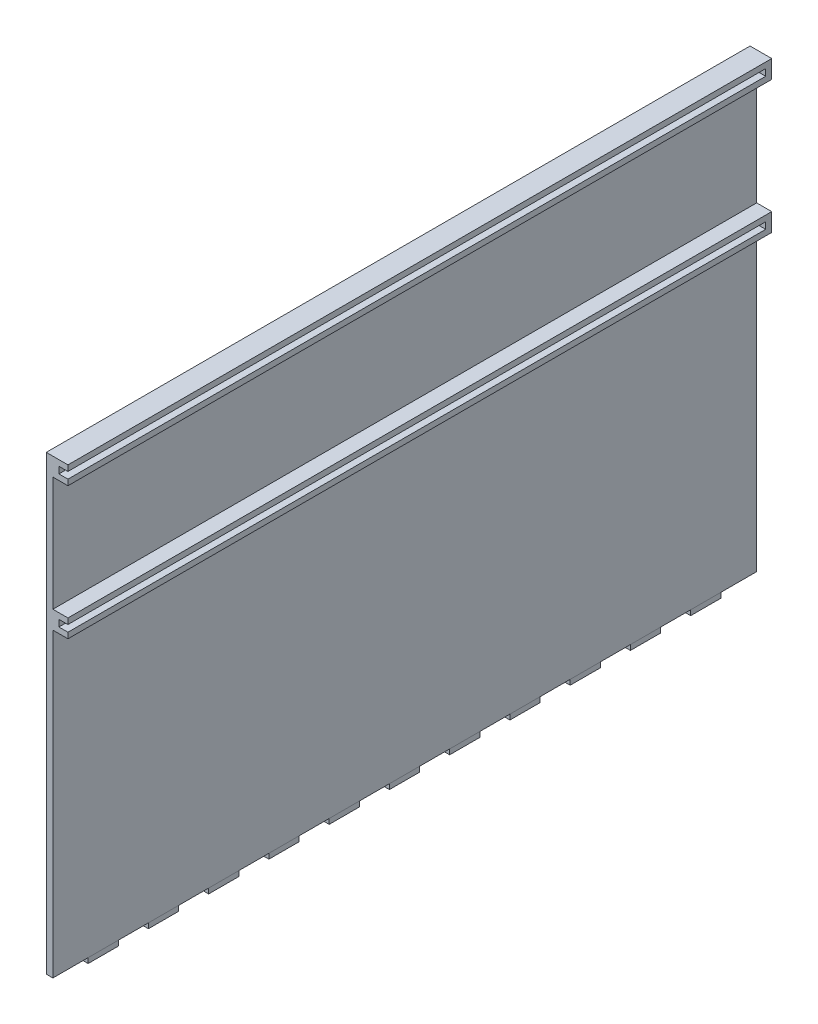
from build123d import *

# Parameters (mm, degrees)
SKETCH_4_W          = 233.6
SKETCH_4_H          = 150
EXTRUDE_2_DEPTH     = 2.2
SKETCH_6_W          = 2
SKETCH_6_H          = 10
EXTRUDE_3_DEPTH     = 1.8
SKETCH_7_W          = 233.6
SKETCH_7_H          = 6
EXTRUDE_4_DEPTH     = 5
SKETCH_8_W          = 114.8
SKETCH_8_H          = 2.2
SKETCH_8_W_2        = 116.8
SKETCH_8_W_3        = 231.6
CUT_EXTRUDE_1_DEPTH = 3


with BuildPart() as part:
    # 草图4 → 凸台-拉伸2 (new body)
    with BuildSketch(Plane(origin=(0, 0, 0), x_dir=(0, 0, -1), z_dir=(1, 0, 0))):
        Rectangle(SKETCH_4_W, SKETCH_4_H)
    extrude(amount=EXTRUDE_2_DEPTH)

    # 草图6 → 凸台-拉伸3 (add)
    with BuildSketch(Plane.XZ.offset(75)):
        with Locations((1.1, 20)):
            Rectangle(SKETCH_6_W, SKETCH_6_H)
        with Locations((1.1, 0)):
            Rectangle(SKETCH_6_W, SKETCH_6_H)
        with Locations((1.1, 40)):
            Rectangle(SKETCH_6_W, SKETCH_6_H)
        with Locations((1.1, 60)):
            Rectangle(SKETCH_6_W, SKETCH_6_H)
        with Locations((1.1, 80)):
            Rectangle(SKETCH_6_W, SKETCH_6_H)
        with Locations((1.1, 100)):
            Rectangle(SKETCH_6_W, SKETCH_6_H)
        with Locations((1.1, -20)):
            Rectangle(SKETCH_6_W, SKETCH_6_H)
        with Locations((1.1, -40)):
            Rectangle(SKETCH_6_W, SKETCH_6_H)
        with Locations((1.1, -60)):
            Rectangle(SKETCH_6_W, SKETCH_6_H)
        with Locations((1.1, -80)):
            Rectangle(SKETCH_6_W, SKETCH_6_H)
        with Locations((1.1, -100)):
            Rectangle(SKETCH_6_W, SKETCH_6_H)
    extrude(amount=EXTRUDE_3_DEPTH)

    # 草图7 → 凸台-拉伸4 (add)
    with BuildSketch(Plane(origin=(2.2, 0, 0), x_dir=(0, 0, -1), z_dir=(1, 0, 0))):
        with Locations((0, 28)):
            Rectangle(SKETCH_7_W, SKETCH_7_H)
        with Locations((0, 72)):
            Rectangle(SKETCH_7_W, SKETCH_7_H)
    extrude(amount=EXTRUDE_4_DEPTH)

    # 草图8 → 切除-拉伸1 (cut)
    with BuildSketch(Plane(origin=(7.2, 0, 0), x_dir=(0, 0, -1), z_dir=(1, 0, 0))):
        with Locations((57.4, 28)):
            Rectangle(SKETCH_8_W, SKETCH_8_H)
        with Locations((-58.4, 28)):
            Rectangle(SKETCH_8_W_2, SKETCH_8_H)
        with Locations((-1, 72)):
            Rectangle(SKETCH_8_W_3, SKETCH_8_H)
    extrude(amount=-CUT_EXTRUDE_1_DEPTH, mode=Mode.SUBTRACT)


solid = part.part
